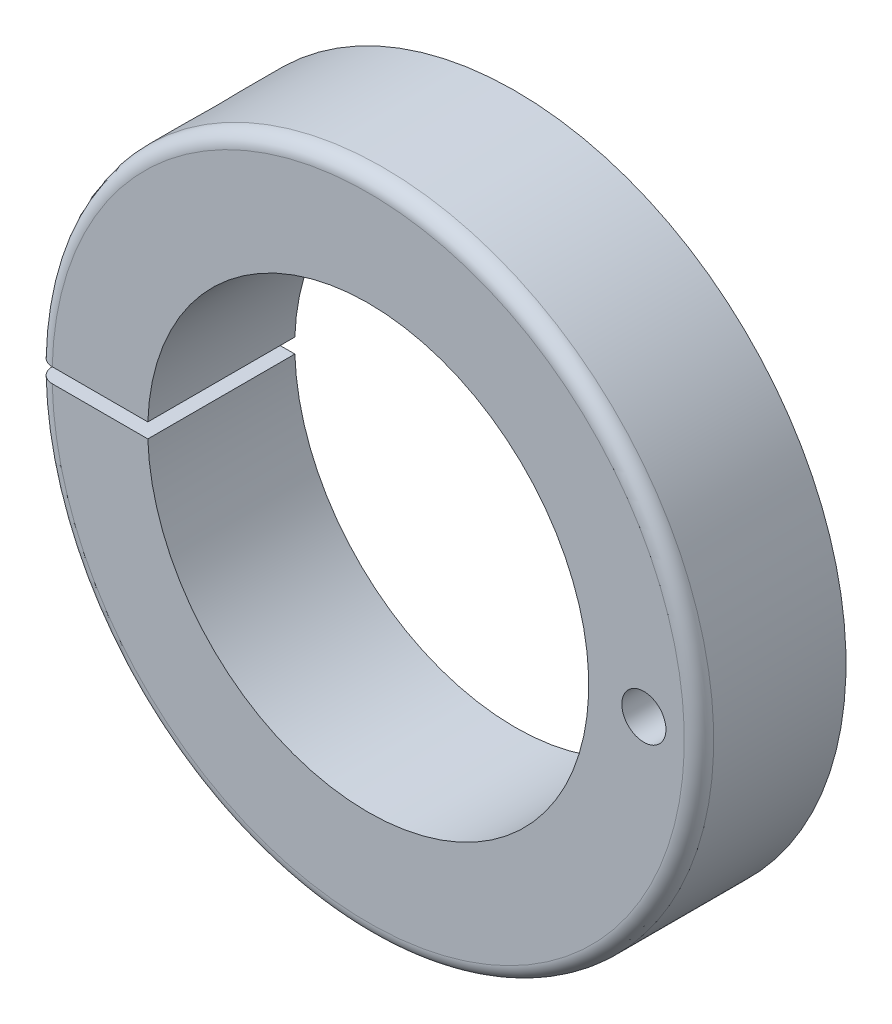
from build123d import *

# Parameters (mm, degrees)
ESQUISSE1_R             = 45
BASE_EXTRUSION_DEPTH    = 20
ESQUISSE2_R             = 30
ENL_V_MAT_EXTRU_1_DEPTH = 20
ESQUISSE3_W             = 30
ESQUISSE3_H             = 2
ENL_V_MAT_EXTRU_2_DEPTH = 20
ESQUISSE4_R             = 3
ENL_V_MAT_EXTRU_3_DEPTH = 103.591422643
ESQUISSE5_R             = 7
ENL_V_MAT_EXTRU_4_DEPTH = 40
CONG_1_R                = 2
ESQUISSE6_R             = 3
ENL_V_MAT_EXTRU_5_DEPTH = 20


with BuildPart() as part:
    # Esquisse1 → Base-Extrusion (new body)
    with BuildSketch(Plane.XY):
        Circle(ESQUISSE1_R)
    extrude(amount=BASE_EXTRUSION_DEPTH)

    # Esquisse2 → Enlèv. mat.-Extru.1 (cut)
    with BuildSketch(Plane.XY.offset(20)):
        Circle(ESQUISSE2_R)
    extrude(amount=-ENL_V_MAT_EXTRU_1_DEPTH, mode=Mode.SUBTRACT)

    # Esquisse3 → Enlèv. mat.-Extru.2 (cut)
    with BuildSketch(Plane.XY.offset(20)):
        with Locations((-35, 0)):
            Rectangle(ESQUISSE3_W, ESQUISSE3_H)
    extrude(amount=-ENL_V_MAT_EXTRU_2_DEPTH, mode=Mode.SUBTRACT)

    # Esquisse4 → Enlèv. mat.-Extru.3 (cut, through all)
    with BuildSketch(Plane(origin=(0, 45, 0), x_dir=(-1, 0, 0), z_dir=(0, 1, 0))):
        with Locations(Location((37.5, 10, 0), (0, 0, 90))):
            Circle(ESQUISSE4_R)
    extrude(amount=-ENL_V_MAT_EXTRU_3_DEPTH, mode=Mode.SUBTRACT)

    # Esquisse5 → Enlèv. mat.-Extru.4 (cut)
    with BuildSketch(Plane(origin=(0, 45, 0), x_dir=(-1, 0, 0), z_dir=(0, 1, 0))):
        with Locations(Location((37.5, 10, 0), (0, 0, 90))):
            Circle(ESQUISSE5_R)
    extrude(amount=-ENL_V_MAT_EXTRU_4_DEPTH, mode=Mode.SUBTRACT)

    # Congé1
    cong_1_edges = [part.edges().sort_by_distance(p)[0] for p in [
        (0.500030871, 44.997221793, 20),
        (0.500030871, -44.997221793, 20),
    ]]
    fillet(cong_1_edges, radius=CONG_1_R)

    # Esquisse6 → Enlèv. mat.-Extru.5 (cut)
    with BuildSketch(Plane.XY.offset(20)):
        with Locations((37.5, 0)):
            Circle(ESQUISSE6_R)
    extrude(amount=-ENL_V_MAT_EXTRU_5_DEPTH, mode=Mode.SUBTRACT)


solid = part.part
